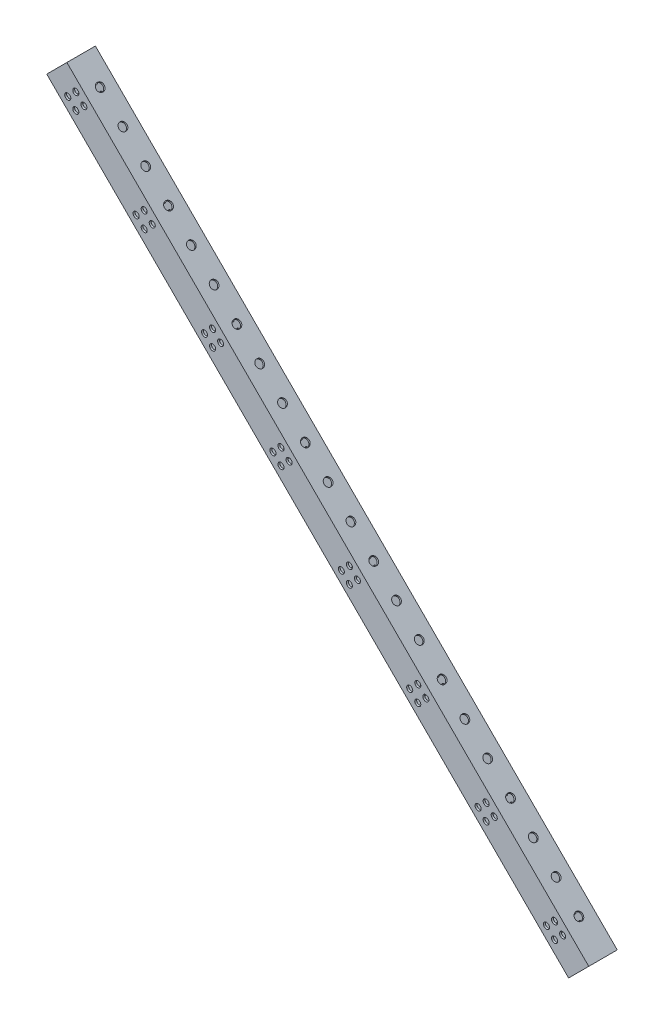
from build123d import *

# Parameters (mm, degrees)
EXTRUDE_1_DEPTH     = 15
SKETCH_3_W          = 13
SKETCH_3_H          = 13
CUT_EXTRUDE_2_DEPTH = 791.959594929
SKETCH_4_R          = 1.6
CUT_EXTRUDE_3_DEPTH = 15
CUT_EXTRUDE_4_REACH = 413.253
SKETCH_5_R          = 2.1
SKETCH_6_W          = 15
SKETCH_6_H          = 15
CUT_EXTRUDE_5_DEPTH = 403.479797464


with BuildPart() as part:
    # 草图1 → 凸台-拉伸1 (new body)
    with BuildSketch(Plane.XY):
        Polygon((5.303300859, 565.303300859), (-5.303300859, 554.696699141), (554.696699141, -5.303300859), (565.303300859, 5.303300859), align=None)
    extrude(amount=EXTRUDE_1_DEPTH)

    # 草图3 → 切除-拉伸2 (cut)
    with BuildSketch(Plane(origin=(-280, 280, 0), x_dir=(0, 0, 1), z_dir=(-0.7071067811865449, 0.7071067811865501, 0))):
        with Locations((7.5, 395.979797464)):
            Rectangle(SKETCH_3_W, SKETCH_3_H)
    extrude(amount=-CUT_EXTRUDE_2_DEPTH, mode=Mode.SUBTRACT)

    # 草图4 → 切除-拉伸3 (cut)
    with BuildSketch(Plane.XY.offset(15)):
        with Locations((5.757359313, 550)):
            Circle(SKETCH_4_R)
        with Locations((10, 554.242640687)):
            Circle(SKETCH_4_R)
        with Locations((10, 545.757359313)):
            Circle(SKETCH_4_R)
        with Locations((14.242640687, 550)):
            Circle(SKETCH_4_R)
        with Locations((41.757359316, 513.999999997)):
            Circle(SKETCH_4_R)
        with Locations((46.000000003, 518.242640684)):
            Circle(SKETCH_4_R)
        with Locations((50.24264069, 513.999999997)):
            Circle(SKETCH_4_R)
        with Locations((46.000000003, 509.75735931)):
            Circle(SKETCH_4_R)
        with Locations((77.757359319, 477.999999994)):
            Circle(SKETCH_4_R)
        with Locations((82.000000006, 482.242640681)):
            Circle(SKETCH_4_R)
        with Locations((86.242640694, 477.999999994)):
            Circle(SKETCH_4_R)
        with Locations((82.000000006, 473.757359306)):
            Circle(SKETCH_4_R)
        with Locations((113.757359323, 441.99999999)):
            Circle(SKETCH_4_R)
        with Locations((118.00000001, 446.242640677)):
            Circle(SKETCH_4_R)
        with Locations((122.242640697, 441.99999999)):
            Circle(SKETCH_4_R)
        with Locations((118.00000001, 437.757359303)):
            Circle(SKETCH_4_R)
        with Locations((149.757359326, 405.999999987)):
            Circle(SKETCH_4_R)
        with Locations((154.000000013, 410.242640674)):
            Circle(SKETCH_4_R)
        with Locations((158.2426407, 405.999999987)):
            Circle(SKETCH_4_R)
        with Locations((154.000000013, 401.7573593)):
            Circle(SKETCH_4_R)
        with Locations((185.757359329, 369.999999984)):
            Circle(SKETCH_4_R)
        with Locations((190.000000016, 374.242640671)):
            Circle(SKETCH_4_R)
        with Locations((194.242640703, 369.999999984)):
            Circle(SKETCH_4_R)
        with Locations((190.000000016, 365.757359297)):
            Circle(SKETCH_4_R)
        with Locations((221.757359332, 333.999999981)):
            Circle(SKETCH_4_R)
        with Locations((226.000000019, 338.242640668)):
            Circle(SKETCH_4_R)
        with Locations((230.242640707, 333.999999981)):
            Circle(SKETCH_4_R)
        with Locations((226.000000019, 329.757359293)):
            Circle(SKETCH_4_R)
        with Locations((257.757359335, 297.999999977)):
            Circle(SKETCH_4_R)
        with Locations((262.000000023, 302.242640665)):
            Circle(SKETCH_4_R)
        with Locations((266.24264071, 297.999999977)):
            Circle(SKETCH_4_R)
        with Locations((262.000000023, 293.75735929)):
            Circle(SKETCH_4_R)
        with Locations((293.757359339, 261.999999974)):
            Circle(SKETCH_4_R)
        with Locations((298.000000026, 266.242640661)):
            Circle(SKETCH_4_R)
        with Locations((302.242640713, 261.999999974)):
            Circle(SKETCH_4_R)
        with Locations((298.000000026, 257.757359287)):
            Circle(SKETCH_4_R)
        with Locations((329.757359342, 225.999999971)):
            Circle(SKETCH_4_R)
        with Locations((334.000000029, 230.242640658)):
            Circle(SKETCH_4_R)
        with Locations((338.242640716, 225.999999971)):
            Circle(SKETCH_4_R)
        with Locations((334.000000029, 221.757359284)):
            Circle(SKETCH_4_R)
        with Locations((365.757359345, 189.999999968)):
            Circle(SKETCH_4_R)
        with Locations((370.000000032, 194.242640655)):
            Circle(SKETCH_4_R)
        with Locations((374.242640719, 189.999999968)):
            Circle(SKETCH_4_R)
        with Locations((370.000000032, 185.757359281)):
            Circle(SKETCH_4_R)
        with Locations((401.757359348, 153.999999964)):
            Circle(SKETCH_4_R)
        with Locations((406.000000036, 158.242640652)):
            Circle(SKETCH_4_R)
        with Locations((410.242640723, 153.999999964)):
            Circle(SKETCH_4_R)
        with Locations((406.000000036, 149.757359277)):
            Circle(SKETCH_4_R)
        with Locations((437.757359352, 117.999999961)):
            Circle(SKETCH_4_R)
        with Locations((442.000000039, 122.242640648)):
            Circle(SKETCH_4_R)
        with Locations((446.242640726, 117.999999961)):
            Circle(SKETCH_4_R)
        with Locations((442.000000039, 113.757359274)):
            Circle(SKETCH_4_R)
        with Locations((473.757359355, 81.999999958)):
            Circle(SKETCH_4_R)
        with Locations((478.000000042, 86.242640645)):
            Circle(SKETCH_4_R)
        with Locations((482.242640729, 81.999999958)):
            Circle(SKETCH_4_R)
        with Locations((478.000000042, 77.757359271)):
            Circle(SKETCH_4_R)
        with Locations((509.757359358, 45.999999955)):
            Circle(SKETCH_4_R)
        with Locations((514.000000045, 50.242640642)):
            Circle(SKETCH_4_R)
        with Locations((518.242640732, 45.999999955)):
            Circle(SKETCH_4_R)
        with Locations((514.000000045, 41.757359268)):
            Circle(SKETCH_4_R)
        with Locations((545.757359361, 9.999999952)):
            Circle(SKETCH_4_R)
        with Locations((550.000000048, 14.242640639)):
            Circle(SKETCH_4_R)
        with Locations((554.242640736, 9.999999952)):
            Circle(SKETCH_4_R)
        with Locations((550.000000048, 5.757359264)):
            Circle(SKETCH_4_R)
    extrude(amount=-CUT_EXTRUDE_3_DEPTH, mode=Mode.SUBTRACT)

    # 切除-拉伸4: up to this face of the body (flat: up to its plane)
    cut_extrude_4_end = Plane(part.part.faces().sort_by_distance((285.303300859, 285.303300859, 7.5))[0])
    # 草图5 → 切除-拉伸4 (cut, up to the picked face)
    with BuildSketch(Plane(origin=(274.696699141, 274.696699141, 0), x_dir=(0, 0, 1), z_dir=(-0.7071067811865503, -0.7071067811865447, 0)), mode=Mode.PRIVATE) as cut_extrude_4_sk1:
        with Locations(Location((7.5, 381.837661841, 0), (0, 0, 270))):
            Circle(SKETCH_5_R)
    cut_extrude_4_tool1 = split(extrude(cut_extrude_4_sk1.sketch, amount=-CUT_EXTRUDE_4_REACH, mode=Mode.PRIVATE), bisect_by=cut_extrude_4_end, keep=Keep.BOTH, mode=Mode.PRIVATE)
    # 草图5 → 切除-拉伸4 (cut, up to the picked face)
    with BuildSketch(Plane(origin=(274.696699141, 274.696699141, 0), x_dir=(0, 0, 1), z_dir=(-0.7071067811865503, -0.7071067811865447, 0)), mode=Mode.PRIVATE) as cut_extrude_4_sk2:
        with Locations(Location((7.5, 364.867099092, 0), (0, 0, 270))):
            Circle(SKETCH_5_R)
    cut_extrude_4_tool2 = split(extrude(cut_extrude_4_sk2.sketch, amount=-CUT_EXTRUDE_4_REACH, mode=Mode.PRIVATE), bisect_by=cut_extrude_4_end, keep=Keep.BOTH, mode=Mode.PRIVATE)
    # 草图5 → 切除-拉伸4 (cut, up to the picked face)
    with BuildSketch(Plane(origin=(274.696699141, 274.696699141, 0), x_dir=(0, 0, 1), z_dir=(-0.7071067811865503, -0.7071067811865447, 0)), mode=Mode.PRIVATE) as cut_extrude_4_sk3:
        with Locations(Location((7.5, 347.896536344, 0), (0, 0, 270))):
            Circle(SKETCH_5_R)
    cut_extrude_4_tool3 = split(extrude(cut_extrude_4_sk3.sketch, amount=-CUT_EXTRUDE_4_REACH, mode=Mode.PRIVATE), bisect_by=cut_extrude_4_end, keep=Keep.BOTH, mode=Mode.PRIVATE)
    # 草图5 → 切除-拉伸4 (cut, up to the picked face)
    with BuildSketch(Plane(origin=(274.696699141, 274.696699141, 0), x_dir=(0, 0, 1), z_dir=(-0.7071067811865503, -0.7071067811865447, 0)), mode=Mode.PRIVATE) as cut_extrude_4_sk4:
        with Locations(Location((7.5, 330.925973595, 0), (0, 0, 270))):
            Circle(SKETCH_5_R)
    cut_extrude_4_tool4 = split(extrude(cut_extrude_4_sk4.sketch, amount=-CUT_EXTRUDE_4_REACH, mode=Mode.PRIVATE), bisect_by=cut_extrude_4_end, keep=Keep.BOTH, mode=Mode.PRIVATE)
    # 草图5 → 切除-拉伸4 (cut, up to the picked face)
    with BuildSketch(Plane(origin=(274.696699141, 274.696699141, 0), x_dir=(0, 0, 1), z_dir=(-0.7071067811865503, -0.7071067811865447, 0)), mode=Mode.PRIVATE) as cut_extrude_4_sk5:
        with Locations(Location((7.5, 313.955410847, 0), (0, 0, 270))):
            Circle(SKETCH_5_R)
    cut_extrude_4_tool5 = split(extrude(cut_extrude_4_sk5.sketch, amount=-CUT_EXTRUDE_4_REACH, mode=Mode.PRIVATE), bisect_by=cut_extrude_4_end, keep=Keep.BOTH, mode=Mode.PRIVATE)
    # 草图5 → 切除-拉伸4 (cut, up to the picked face)
    with BuildSketch(Plane(origin=(274.696699141, 274.696699141, 0), x_dir=(0, 0, 1), z_dir=(-0.7071067811865503, -0.7071067811865447, 0)), mode=Mode.PRIVATE) as cut_extrude_4_sk6:
        with Locations(Location((7.5, 296.984848098, 0), (0, 0, 270))):
            Circle(SKETCH_5_R)
    cut_extrude_4_tool6 = split(extrude(cut_extrude_4_sk6.sketch, amount=-CUT_EXTRUDE_4_REACH, mode=Mode.PRIVATE), bisect_by=cut_extrude_4_end, keep=Keep.BOTH, mode=Mode.PRIVATE)
    # 草图5 → 切除-拉伸4 (cut, up to the picked face)
    with BuildSketch(Plane(origin=(274.696699141, 274.696699141, 0), x_dir=(0, 0, 1), z_dir=(-0.7071067811865503, -0.7071067811865447, 0)), mode=Mode.PRIVATE) as cut_extrude_4_sk7:
        with Locations(Location((7.5, 280.01428535, 0), (0, 0, 270))):
            Circle(SKETCH_5_R)
    cut_extrude_4_tool7 = split(extrude(cut_extrude_4_sk7.sketch, amount=-CUT_EXTRUDE_4_REACH, mode=Mode.PRIVATE), bisect_by=cut_extrude_4_end, keep=Keep.BOTH, mode=Mode.PRIVATE)
    # 草图5 → 切除-拉伸4 (cut, up to the picked face)
    with BuildSketch(Plane(origin=(274.696699141, 274.696699141, 0), x_dir=(0, 0, 1), z_dir=(-0.7071067811865503, -0.7071067811865447, 0)), mode=Mode.PRIVATE) as cut_extrude_4_sk8:
        with Locations(Location((7.5, 263.043722601, 0), (0, 0, 270))):
            Circle(SKETCH_5_R)
    cut_extrude_4_tool8 = split(extrude(cut_extrude_4_sk8.sketch, amount=-CUT_EXTRUDE_4_REACH, mode=Mode.PRIVATE), bisect_by=cut_extrude_4_end, keep=Keep.BOTH, mode=Mode.PRIVATE)
    # 草图5 → 切除-拉伸4 (cut, up to the picked face)
    with BuildSketch(Plane(origin=(274.696699141, 274.696699141, 0), x_dir=(0, 0, 1), z_dir=(-0.7071067811865503, -0.7071067811865447, 0)), mode=Mode.PRIVATE) as cut_extrude_4_sk9:
        with Locations(Location((7.5, 246.073159853, 0), (0, 0, 270))):
            Circle(SKETCH_5_R)
    cut_extrude_4_tool9 = split(extrude(cut_extrude_4_sk9.sketch, amount=-CUT_EXTRUDE_4_REACH, mode=Mode.PRIVATE), bisect_by=cut_extrude_4_end, keep=Keep.BOTH, mode=Mode.PRIVATE)
    # 草图5 → 切除-拉伸4 (cut, up to the picked face)
    with BuildSketch(Plane(origin=(274.696699141, 274.696699141, 0), x_dir=(0, 0, 1), z_dir=(-0.7071067811865503, -0.7071067811865447, 0)), mode=Mode.PRIVATE) as cut_extrude_4_sk10:
        with Locations(Location((7.5, 229.102597104, 0), (0, 0, 270))):
            Circle(SKETCH_5_R)
    cut_extrude_4_tool10 = split(extrude(cut_extrude_4_sk10.sketch, amount=-CUT_EXTRUDE_4_REACH, mode=Mode.PRIVATE), bisect_by=cut_extrude_4_end, keep=Keep.BOTH, mode=Mode.PRIVATE)
    # 草图5 → 切除-拉伸4 (cut, up to the picked face)
    with BuildSketch(Plane(origin=(274.696699141, 274.696699141, 0), x_dir=(0, 0, 1), z_dir=(-0.7071067811865503, -0.7071067811865447, 0)), mode=Mode.PRIVATE) as cut_extrude_4_sk11:
        with Locations(Location((7.5, 212.132034356, 0), (0, 0, 270))):
            Circle(SKETCH_5_R)
    cut_extrude_4_tool11 = split(extrude(cut_extrude_4_sk11.sketch, amount=-CUT_EXTRUDE_4_REACH, mode=Mode.PRIVATE), bisect_by=cut_extrude_4_end, keep=Keep.BOTH, mode=Mode.PRIVATE)
    # 草图5 → 切除-拉伸4 (cut, up to the picked face)
    with BuildSketch(Plane(origin=(274.696699141, 274.696699141, 0), x_dir=(0, 0, 1), z_dir=(-0.7071067811865503, -0.7071067811865447, 0)), mode=Mode.PRIVATE) as cut_extrude_4_sk12:
        with Locations(Location((7.5, 195.161471607, 0), (0, 0, 270))):
            Circle(SKETCH_5_R)
    cut_extrude_4_tool12 = split(extrude(cut_extrude_4_sk12.sketch, amount=-CUT_EXTRUDE_4_REACH, mode=Mode.PRIVATE), bisect_by=cut_extrude_4_end, keep=Keep.BOTH, mode=Mode.PRIVATE)
    # 草图5 → 切除-拉伸4 (cut, up to the picked face)
    with BuildSketch(Plane(origin=(274.696699141, 274.696699141, 0), x_dir=(0, 0, 1), z_dir=(-0.7071067811865503, -0.7071067811865447, 0)), mode=Mode.PRIVATE) as cut_extrude_4_sk13:
        with Locations(Location((7.5, 178.190908859, 0), (0, 0, 270))):
            Circle(SKETCH_5_R)
    cut_extrude_4_tool13 = split(extrude(cut_extrude_4_sk13.sketch, amount=-CUT_EXTRUDE_4_REACH, mode=Mode.PRIVATE), bisect_by=cut_extrude_4_end, keep=Keep.BOTH, mode=Mode.PRIVATE)
    # 草图5 → 切除-拉伸4 (cut, up to the picked face)
    with BuildSketch(Plane(origin=(274.696699141, 274.696699141, 0), x_dir=(0, 0, 1), z_dir=(-0.7071067811865503, -0.7071067811865447, 0)), mode=Mode.PRIVATE) as cut_extrude_4_sk14:
        with Locations(Location((7.5, 161.220346111, 0), (0, 0, 270))):
            Circle(SKETCH_5_R)
    cut_extrude_4_tool14 = split(extrude(cut_extrude_4_sk14.sketch, amount=-CUT_EXTRUDE_4_REACH, mode=Mode.PRIVATE), bisect_by=cut_extrude_4_end, keep=Keep.BOTH, mode=Mode.PRIVATE)
    # 草图5 → 切除-拉伸4 (cut, up to the picked face)
    with BuildSketch(Plane(origin=(274.696699141, 274.696699141, 0), x_dir=(0, 0, 1), z_dir=(-0.7071067811865503, -0.7071067811865447, 0)), mode=Mode.PRIVATE) as cut_extrude_4_sk15:
        with Locations(Location((7.5, 144.249783362, 0), (0, 0, 270))):
            Circle(SKETCH_5_R)
    cut_extrude_4_tool15 = split(extrude(cut_extrude_4_sk15.sketch, amount=-CUT_EXTRUDE_4_REACH, mode=Mode.PRIVATE), bisect_by=cut_extrude_4_end, keep=Keep.BOTH, mode=Mode.PRIVATE)
    # 草图5 → 切除-拉伸4 (cut, up to the picked face)
    with BuildSketch(Plane(origin=(274.696699141, 274.696699141, 0), x_dir=(0, 0, 1), z_dir=(-0.7071067811865503, -0.7071067811865447, 0)), mode=Mode.PRIVATE) as cut_extrude_4_sk16:
        with Locations(Location((7.5, 127.279220614, 0), (0, 0, 270))):
            Circle(SKETCH_5_R)
    cut_extrude_4_tool16 = split(extrude(cut_extrude_4_sk16.sketch, amount=-CUT_EXTRUDE_4_REACH, mode=Mode.PRIVATE), bisect_by=cut_extrude_4_end, keep=Keep.BOTH, mode=Mode.PRIVATE)
    # 草图5 → 切除-拉伸4 (cut, up to the picked face)
    with BuildSketch(Plane(origin=(274.696699141, 274.696699141, 0), x_dir=(0, 0, 1), z_dir=(-0.7071067811865503, -0.7071067811865447, 0)), mode=Mode.PRIVATE) as cut_extrude_4_sk17:
        with Locations(Location((7.5, 110.308657865, 0), (0, 0, 270))):
            Circle(SKETCH_5_R)
    cut_extrude_4_tool17 = split(extrude(cut_extrude_4_sk17.sketch, amount=-CUT_EXTRUDE_4_REACH, mode=Mode.PRIVATE), bisect_by=cut_extrude_4_end, keep=Keep.BOTH, mode=Mode.PRIVATE)
    # 草图5 → 切除-拉伸4 (cut, up to the picked face)
    with BuildSketch(Plane(origin=(274.696699141, 274.696699141, 0), x_dir=(0, 0, 1), z_dir=(-0.7071067811865503, -0.7071067811865447, 0)), mode=Mode.PRIVATE) as cut_extrude_4_sk18:
        with Locations(Location((7.5, 93.338095117, 0), (0, 0, 270))):
            Circle(SKETCH_5_R)
    cut_extrude_4_tool18 = split(extrude(cut_extrude_4_sk18.sketch, amount=-CUT_EXTRUDE_4_REACH, mode=Mode.PRIVATE), bisect_by=cut_extrude_4_end, keep=Keep.BOTH, mode=Mode.PRIVATE)
    # 草图5 → 切除-拉伸4 (cut, up to the picked face)
    with BuildSketch(Plane(origin=(274.696699141, 274.696699141, 0), x_dir=(0, 0, 1), z_dir=(-0.7071067811865503, -0.7071067811865447, 0)), mode=Mode.PRIVATE) as cut_extrude_4_sk19:
        with Locations(Location((7.5, 76.367532368, 0), (0, 0, 270))):
            Circle(SKETCH_5_R)
    cut_extrude_4_tool19 = split(extrude(cut_extrude_4_sk19.sketch, amount=-CUT_EXTRUDE_4_REACH, mode=Mode.PRIVATE), bisect_by=cut_extrude_4_end, keep=Keep.BOTH, mode=Mode.PRIVATE)
    # 草图5 → 切除-拉伸4 (cut, up to the picked face)
    with BuildSketch(Plane(origin=(274.696699141, 274.696699141, 0), x_dir=(0, 0, 1), z_dir=(-0.7071067811865503, -0.7071067811865447, 0)), mode=Mode.PRIVATE) as cut_extrude_4_sk20:
        with Locations(Location((7.5, 59.39696962, 0), (0, 0, 270))):
            Circle(SKETCH_5_R)
    cut_extrude_4_tool20 = split(extrude(cut_extrude_4_sk20.sketch, amount=-CUT_EXTRUDE_4_REACH, mode=Mode.PRIVATE), bisect_by=cut_extrude_4_end, keep=Keep.BOTH, mode=Mode.PRIVATE)
    # 草图5 → 切除-拉伸4 (cut, up to the picked face)
    with BuildSketch(Plane(origin=(274.696699141, 274.696699141, 0), x_dir=(0, 0, 1), z_dir=(-0.7071067811865503, -0.7071067811865447, 0)), mode=Mode.PRIVATE) as cut_extrude_4_sk21:
        with Locations(Location((7.5, 42.426406871, 0), (0, 0, 270))):
            Circle(SKETCH_5_R)
    cut_extrude_4_tool21 = split(extrude(cut_extrude_4_sk21.sketch, amount=-CUT_EXTRUDE_4_REACH, mode=Mode.PRIVATE), bisect_by=cut_extrude_4_end, keep=Keep.BOTH, mode=Mode.PRIVATE)
    # 草图5 → 切除-拉伸4 (cut, up to the picked face)
    with BuildSketch(Plane(origin=(274.696699141, 274.696699141, 0), x_dir=(0, 0, 1), z_dir=(-0.7071067811865503, -0.7071067811865447, 0)), mode=Mode.PRIVATE) as cut_extrude_4_sk22:
        with Locations(Location((7.5, 25.455844123, 0), (0, 0, 270))):
            Circle(SKETCH_5_R)
    cut_extrude_4_tool22 = split(extrude(cut_extrude_4_sk22.sketch, amount=-CUT_EXTRUDE_4_REACH, mode=Mode.PRIVATE), bisect_by=cut_extrude_4_end, keep=Keep.BOTH, mode=Mode.PRIVATE)
    add(cut_extrude_4_tool1.solids().sort_by(Axis((4.696699, 544.696699, 7.5), (0.7071067811865503, 0.7071067811865447, 0)))[0], mode=Mode.SUBTRACT)
    add(cut_extrude_4_tool2.solids().sort_by(Axis((16.696699, 532.696699, 7.5), (0.7071067811865503, 0.7071067811865447, 0)))[0], mode=Mode.SUBTRACT)
    add(cut_extrude_4_tool3.solids().sort_by(Axis((28.696699, 520.696699, 7.5), (0.7071067811865503, 0.7071067811865447, 0)))[0], mode=Mode.SUBTRACT)
    add(cut_extrude_4_tool4.solids().sort_by(Axis((40.696699, 508.696699, 7.5), (0.7071067811865503, 0.7071067811865447, 0)))[0], mode=Mode.SUBTRACT)
    add(cut_extrude_4_tool5.solids().sort_by(Axis((52.696699, 496.696699, 7.5), (0.7071067811865503, 0.7071067811865447, 0)))[0], mode=Mode.SUBTRACT)
    add(cut_extrude_4_tool6.solids().sort_by(Axis((64.696699, 484.696699, 7.5), (0.7071067811865503, 0.7071067811865447, 0)))[0], mode=Mode.SUBTRACT)
    add(cut_extrude_4_tool7.solids().sort_by(Axis((76.696699, 472.696699, 7.5), (0.7071067811865503, 0.7071067811865447, 0)))[0], mode=Mode.SUBTRACT)
    add(cut_extrude_4_tool8.solids().sort_by(Axis((88.696699, 460.696699, 7.5), (0.7071067811865503, 0.7071067811865447, 0)))[0], mode=Mode.SUBTRACT)
    add(cut_extrude_4_tool9.solids().sort_by(Axis((100.696699, 448.696699, 7.5), (0.7071067811865503, 0.7071067811865447, 0)))[0], mode=Mode.SUBTRACT)
    add(cut_extrude_4_tool10.solids().sort_by(Axis((112.696699, 436.696699, 7.5), (0.7071067811865503, 0.7071067811865447, 0)))[0], mode=Mode.SUBTRACT)
    add(cut_extrude_4_tool11.solids().sort_by(Axis((124.696699, 424.696699, 7.5), (0.7071067811865503, 0.7071067811865447, 0)))[0], mode=Mode.SUBTRACT)
    add(cut_extrude_4_tool12.solids().sort_by(Axis((136.696699, 412.696699, 7.5), (0.7071067811865503, 0.7071067811865447, 0)))[0], mode=Mode.SUBTRACT)
    add(cut_extrude_4_tool13.solids().sort_by(Axis((148.696699, 400.696699, 7.5), (0.7071067811865503, 0.7071067811865447, 0)))[0], mode=Mode.SUBTRACT)
    add(cut_extrude_4_tool14.solids().sort_by(Axis((160.696699, 388.696699, 7.5), (0.7071067811865503, 0.7071067811865447, 0)))[0], mode=Mode.SUBTRACT)
    add(cut_extrude_4_tool15.solids().sort_by(Axis((172.696699, 376.696699, 7.5), (0.7071067811865503, 0.7071067811865447, 0)))[0], mode=Mode.SUBTRACT)
    add(cut_extrude_4_tool16.solids().sort_by(Axis((184.696699, 364.696699, 7.5), (0.7071067811865503, 0.7071067811865447, 0)))[0], mode=Mode.SUBTRACT)
    add(cut_extrude_4_tool17.solids().sort_by(Axis((196.696699, 352.696699, 7.5), (0.7071067811865503, 0.7071067811865447, 0)))[0], mode=Mode.SUBTRACT)
    add(cut_extrude_4_tool18.solids().sort_by(Axis((208.696699, 340.696699, 7.5), (0.7071067811865503, 0.7071067811865447, 0)))[0], mode=Mode.SUBTRACT)
    add(cut_extrude_4_tool19.solids().sort_by(Axis((220.696699, 328.696699, 7.5), (0.7071067811865503, 0.7071067811865447, 0)))[0], mode=Mode.SUBTRACT)
    add(cut_extrude_4_tool20.solids().sort_by(Axis((232.696699, 316.696699, 7.5), (0.7071067811865503, 0.7071067811865447, 0)))[0], mode=Mode.SUBTRACT)
    add(cut_extrude_4_tool21.solids().sort_by(Axis((244.696699, 304.696699, 7.5), (0.7071067811865503, 0.7071067811865447, 0)))[0], mode=Mode.SUBTRACT)
    add(cut_extrude_4_tool22.solids().sort_by(Axis((256.696699, 292.696699, 7.5), (0.7071067811865503, 0.7071067811865447, 0)))[0], mode=Mode.SUBTRACT)

    # 草图6 → 切除-拉伸5 (cut)
    with BuildSketch(Plane(origin=(280, -280, 0), x_dir=(0, 0, -1), z_dir=(0.7071067811865293, -0.7071067811865659, 0))):
        with Locations((-7.5, 395.979797464)):
            Rectangle(SKETCH_6_W, SKETCH_6_H)
    extrude(amount=-CUT_EXTRUDE_5_DEPTH, mode=Mode.SUBTRACT)


solid = part.part
